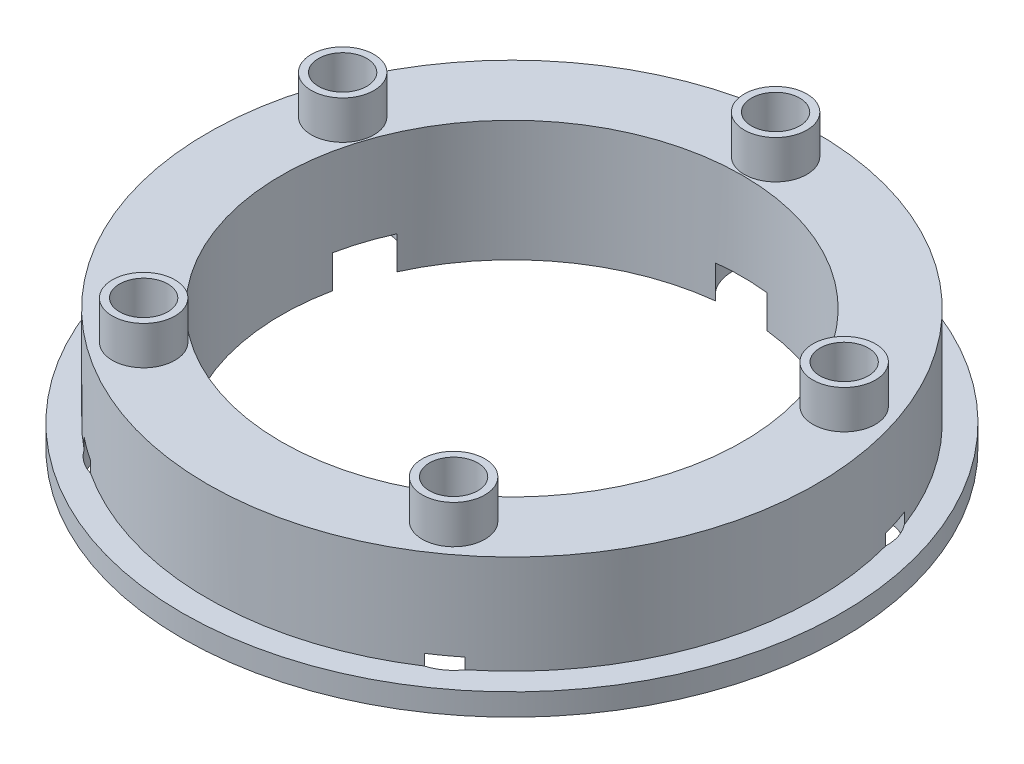
from build123d import *

# Parameters (mm, degrees)
SKETCH3_R           = 27.7
BOSS_EXTRUDE2_DEPTH = 11
SKETCH4_R           = 30
BOSS_EXTRUDE3_DEPTH = 2
SKETCH5_R           = 2.2
CUT_EXTRUDE1_DEPTH  = 44.829214002
SKETCH9_R           = 21
CUT_EXTRUDE5_DEPTH  = 44.829214002
BOSS_EXTRUDE4_START = 3.5
SKETCH10_R          = 2.85
SKETCH10_R_2        = 2.2
BOSS_EXTRUDE4_DEPTH = 3.5
SKETCH15_R          = 3.9
CUT_EXTRUDE6_DEPTH  = 3


with BuildPart() as part:
    # Sketch3 → Boss-Extrude2 (new body)
    with BuildSketch(Plane(origin=(0, 0, 0), x_dir=(1, 0, 0), z_dir=(0, 1, 0))):
        with Locations(Location((0, 0, 0), (0, 0, 270))):
            Circle(SKETCH3_R)
    extrude(amount=BOSS_EXTRUDE2_DEPTH)

    # Sketch4 → Boss-Extrude3 (add)
    with BuildSketch(Plane(origin=(0, 0, 0), x_dir=(1, 0, 0), z_dir=(0, 1, 0))):
        with Locations(Location((0, 0, 0), (0, 0, 270))):
            Circle(SKETCH4_R)
    extrude(amount=BOSS_EXTRUDE3_DEPTH)

    # Sketch5 → Cut-Extrude1 (cut, through all)
    with BuildSketch(Plane(origin=(0, 11, 0), x_dir=(1, 0, 0), z_dir=(0, 1, 0))):
        with Locations(Location((0, 24, 0), (0, 0, 270))):
            Circle(SKETCH5_R)
        with Locations(Location((22.825356391, 7.416407865, 0), (0, 0, 270))):
            Circle(SKETCH5_R)
        with Locations(Location((14.106846055, -19.416407865, 0), (0, 0, 270))):
            Circle(SKETCH5_R)
        with Locations(Location((-14.106846055, -19.416407865, 0), (0, 0, 270))):
            Circle(SKETCH5_R)
        with Locations(Location((-22.825356391, 7.416407865, 0), (0, 0, 270))):
            Circle(SKETCH5_R)
    extrude(amount=-CUT_EXTRUDE1_DEPTH, mode=Mode.SUBTRACT)

    # Sketch9 → Cut-Extrude5 (cut, through all)
    with BuildSketch(Plane(origin=(0, 11, 0), x_dir=(1, 0, 0), z_dir=(0, 1, 0))):
        with Locations(Location((0, 0, 0), (0, 0, 270))):
            Circle(SKETCH9_R)
    extrude(amount=-CUT_EXTRUDE5_DEPTH, mode=Mode.SUBTRACT)

    # Sketch10 → Boss-Extrude4 (add)
    # profile 1 of 5: a face of its own
    with BuildSketch(Plane(origin=(0, 11, 0), x_dir=(1, 0, 0), z_dir=(0, 1, 0)).offset(BOSS_EXTRUDE4_START)):
        with Locations(Location((-22.825356391, 7.416407865, 0), (0, 0, 270))):
            Circle(SKETCH10_R)
        with Locations(Location((-22.825356391, 7.416407865, 0), (0, 0, 270))):
            Circle(SKETCH10_R_2, mode=Mode.SUBTRACT)
    # profile 2 of 5: a face of its own
    with BuildSketch(Plane(origin=(0, 11, 0), x_dir=(1, 0, 0), z_dir=(0, 1, 0)).offset(BOSS_EXTRUDE4_START)):
        with Locations(Location((0, 24, 0), (0, 0, 270))):
            Circle(SKETCH10_R)
        with Locations(Location((0, 24, 0), (0, 0, 270))):
            Circle(SKETCH10_R_2, mode=Mode.SUBTRACT)
    # profile 3 of 5: a face of its own
    with BuildSketch(Plane(origin=(0, 11, 0), x_dir=(1, 0, 0), z_dir=(0, 1, 0)).offset(BOSS_EXTRUDE4_START)):
        with Locations(Location((22.825356391, 7.416407865, 0), (0, 0, 270))):
            Circle(SKETCH10_R)
        with Locations(Location((22.825356391, 7.416407865, 0), (0, 0, 270))):
            Circle(SKETCH10_R_2, mode=Mode.SUBTRACT)
    # profile 4 of 5: a face of its own
    with BuildSketch(Plane(origin=(0, 11, 0), x_dir=(1, 0, 0), z_dir=(0, 1, 0)).offset(BOSS_EXTRUDE4_START)):
        with Locations(Location((14.106846055, -19.416407865, 0), (0, 0, 270))):
            Circle(SKETCH10_R)
        with Locations(Location((14.106846055, -19.416407865, 0), (0, 0, 270))):
            Circle(SKETCH10_R_2, mode=Mode.SUBTRACT)
    # profile 5 of 5: a face of its own
    with BuildSketch(Plane(origin=(0, 11, 0), x_dir=(1, 0, 0), z_dir=(0, 1, 0)).offset(BOSS_EXTRUDE4_START)):
        with Locations(Location((-14.106846055, -19.416407865, 0), (0, 0, 270))):
            Circle(SKETCH10_R)
        with Locations(Location((-14.106846055, -19.416407865, 0), (0, 0, 270))):
            Circle(SKETCH10_R_2, mode=Mode.SUBTRACT)
    extrude(amount=-BOSS_EXTRUDE4_DEPTH)

    # Sketch15 → Cut-Extrude6 (cut)
    with BuildSketch(Plane.XZ):
        with Locations((-14.106846055, 19.416407865)):
            Circle(SKETCH15_R)
        with Locations((14.106846055, 19.416407865)):
            Circle(SKETCH15_R)
        with Locations((22.825356391, -7.416407865)):
            Circle(SKETCH15_R)
        with Locations((0, -24)):
            Circle(SKETCH15_R)
        with Locations((-22.825356391, -7.416407865)):
            Circle(SKETCH15_R)
    extrude(amount=-CUT_EXTRUDE6_DEPTH, mode=Mode.SUBTRACT)


solid = part.part
